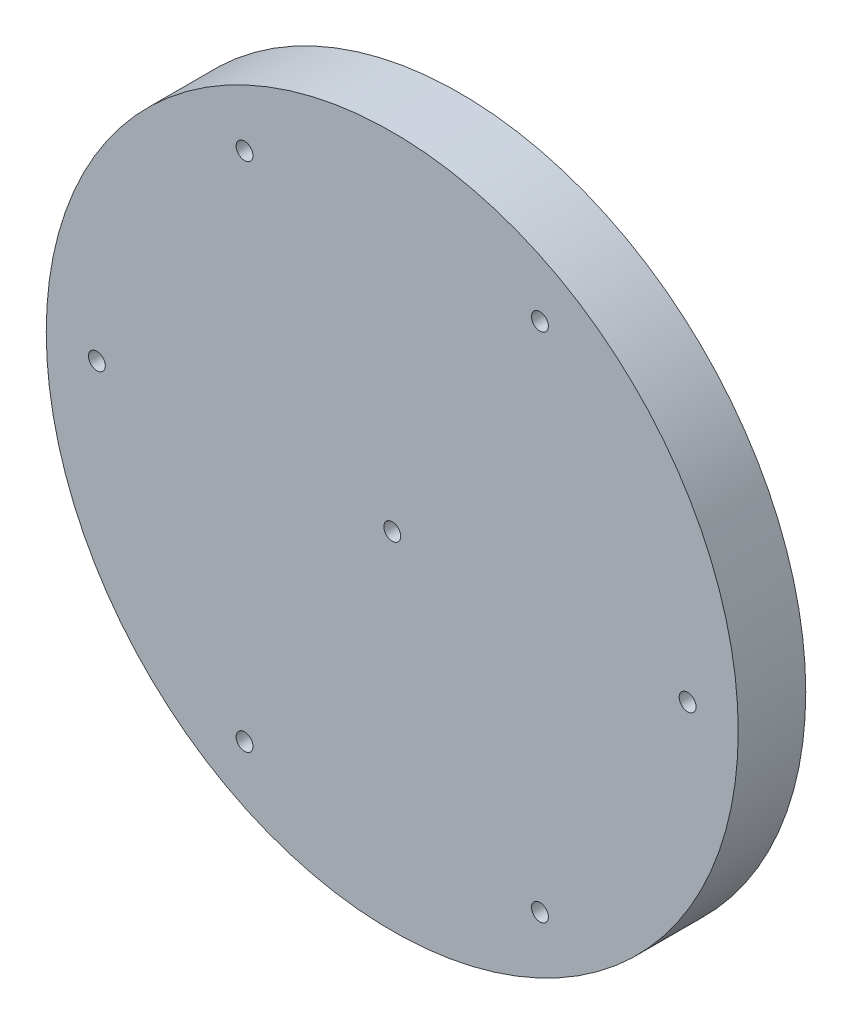
from build123d import *

# Parameters (mm, degrees)
MODEL_R             = 20.5
MODEL_R_2           = 0.5
BOSS_EXTRUDE1_DEPTH = 4


with BuildPart() as part:
    # Model → Boss-Extrude1 (new body)
    with BuildSketch(Plane.XY):
        with Locations((2103.994457195, 1410.063231304)):
            Circle(MODEL_R)
        with Locations((2103.994457195, 1410.063231304)):
            Circle(MODEL_R_2, mode=Mode.SUBTRACT)
        with Locations((2121.494457195, 1410.063231304)):
            Circle(MODEL_R_2, mode=Mode.SUBTRACT)
        with Locations((2112.744457195, 1425.21867587)):
            Circle(MODEL_R_2, mode=Mode.SUBTRACT)
        with Locations((2095.244457195, 1425.21867587)):
            Circle(MODEL_R_2, mode=Mode.SUBTRACT)
        with Locations((2086.494457195, 1410.063231304)):
            Circle(MODEL_R_2, mode=Mode.SUBTRACT)
        with Locations((2095.244457195, 1394.907786738)):
            Circle(MODEL_R_2, mode=Mode.SUBTRACT)
        with Locations((2112.744457195, 1394.907786738)):
            Circle(MODEL_R_2, mode=Mode.SUBTRACT)
    extrude(amount=BOSS_EXTRUDE1_DEPTH)


solid = part.part
